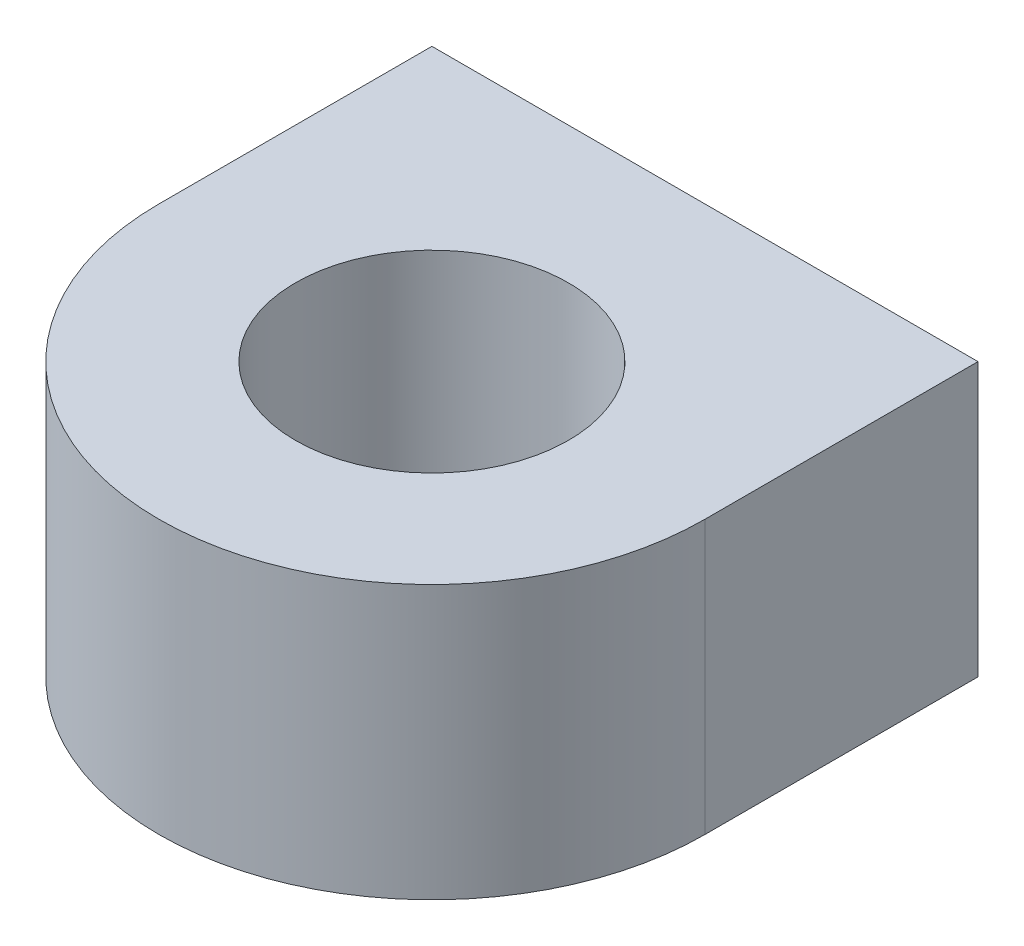
from build123d import *

# Parameters (mm, degrees)
SKETCH1_W           = 10
SKETCH1_H           = 5
BOSS_EXTRUDE1_DEPTH = 10
SKETCH2_R           = 2.5
CUT_EXTRUDE1_DEPTH  = 171.137369091


with BuildPart() as part:
    # Sketch1 → Boss-Extrude1 (new body)
    with BuildSketch(Plane.XY):
        with Locations((164.769621432, 40.044015335)):
            Rectangle(SKETCH1_W, SKETCH1_H)
    extrude(amount=BOSS_EXTRUDE1_DEPTH)

    # Sketch2 → Cut-Extrude1 (cut, through all)
    with BuildSketch(Plane(origin=(0, 42.544015335, 0), x_dir=(1, 0, 0), z_dir=(0, 1, 0))):
        with BuildLine():
            ThreePointArc((164.769621432, -10), (161.234087527, -8.535533906), (159.769621432, -5))
            Line((159.769621432, -5), (159.769621432, -10))
            Line((159.769621432, -10), (164.769621432, -10))
        make_face()
        with BuildLine():
            ThreePointArc((169.769621432, -5), (168.305155338, -8.535533906), (164.769621432, -10))
            Line((164.769621432, -10), (169.769621432, -10))
            Line((169.769621432, -10), (169.769621432, -5))
        make_face()
        with Locations((164.769621432, -5)):
            Circle(SKETCH2_R)
    extrude(amount=-CUT_EXTRUDE1_DEPTH, mode=Mode.SUBTRACT)


solid = part.part
